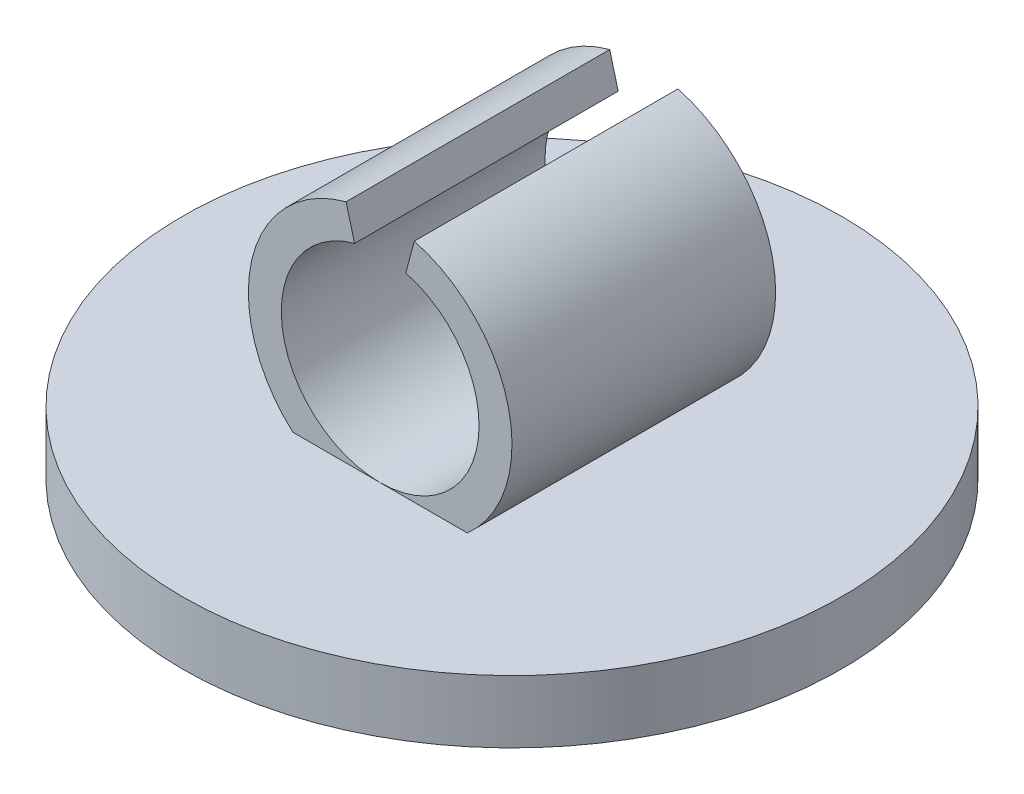
from build123d import *

# Parameters (mm, degrees)
SALIENTE_EXTRUIR1_DEPTH      = 10
SALIENTE_EXTRUIR1_DEPTH_BACK = 10


with BuildPart() as part:
    # Croquis1 → Revolución1 (revolve)
    with BuildSketch(Plane.XY):
        Polygon((0, 0), (3.75, 0), (3.75, 7.5), (25, 7.5), (25, 12.252764843), (0, 12.252764843), align=None)
    revolve(axis=Axis((0, 0, 0), (0, 1, 0)))

    # Croquis2 → Saliente-Extruir1 (add, two sides: drawn at the far end of the back side and taken through both)
    with BuildSketch(Plane.XY.offset(-SALIENTE_EXTRUIR1_DEPTH_BACK)):
        with BuildLine():
            Line((-1.941142838, 26.99720854), (-2.588190451, 29.412023106))
            ThreePointArc((-2.588190451, 29.412023106), (0, 9.752764843), (2.588190451, 29.412023106))
            Line((2.588190451, 29.412023106), (1.941142838, 26.99720854))
            ThreePointArc((1.941142838, 26.99720854), (0, 12.252764843), (-1.941142838, 26.99720854))
        make_face()
    extrude(amount=SALIENTE_EXTRUIR1_DEPTH + SALIENTE_EXTRUIR1_DEPTH_BACK)


solid = part.part
